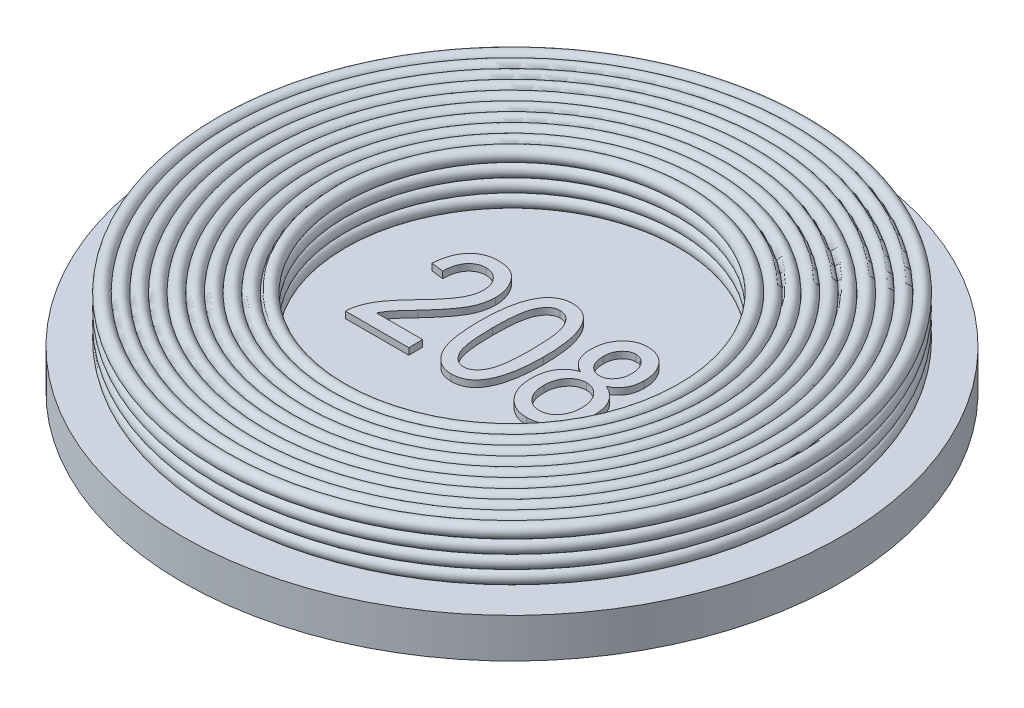
from build123d import *

# Parameters (mm, degrees)
SKETCH3_R           = 5
BOSS_EXTRUDE2_DEPTH = 0.6
BOSS_EXTRUDE3_DEPTH = 0.1


with BuildPart() as part:
    # Sketch2 → Revolve2 (revolve)
    with BuildSketch(Plane.XY, mode=Mode.PRIVATE) as revolve2_sk:
        with BuildLine():
            ThreePointArc((-3.3, 1.3), (-3.4, 1.4), (-3.5, 1.3))
            ThreePointArc((-3.5, 1.3), (-3.6, 1.4), (-3.7, 1.3))
            ThreePointArc((-3.7, 1.3), (-3.8, 1.4), (-3.9, 1.3))
            ThreePointArc((-3.9, 1.3), (-4, 1.4), (-4.1, 1.3))
            ThreePointArc((-4.1, 1.3), (-4.2, 1.4), (-4.3, 1.3))
            ThreePointArc((-4.3, 1.3), (-4.470710678, 1.370710678), (-4.4, 1.2))
            ThreePointArc((-4.4, 1.2), (-4.5, 1.1), (-4.4, 1))
            ThreePointArc((-4.4, 1), (-4.5, 0.9), (-4.4, 0.8))
            ThreePointArc((-4.4, 0.8), (-4.470710678, 0.629289322), (-4.3, 0.7))
            ThreePointArc((-4.3, 0.7), (-4.2, 0.6), (-4.1, 0.7))
            ThreePointArc((-4.1, 0.7), (-4, 0.6), (-3.9, 0.7))
            ThreePointArc((-3.9, 0.7), (-3.8, 0.6), (-3.7, 0.7))
            ThreePointArc((-3.7, 0.7), (-3.6, 0.6), (-3.5, 0.7))
            ThreePointArc((-3.5, 0.7), (-3.4, 0.6), (-3.3, 0.7))
            ThreePointArc((-3.3, 0.7), (-3.2, 0.6), (-3.1, 0.7))
            ThreePointArc((-3.1, 0.7), (-3, 0.6), (-2.9, 0.7))
            ThreePointArc((-2.9, 0.7), (-2.8, 0.6), (-2.7, 0.7))
            ThreePointArc((-2.7, 0.7), (-2.529289322, 0.629289322), (-2.6, 0.8))
            ThreePointArc((-2.6, 0.8), (-2.5, 0.9), (-2.6, 1))
            ThreePointArc((-2.6, 1), (-2.5, 1.1), (-2.6, 1.2))
            ThreePointArc((-2.6, 1.2), (-2.529289322, 1.370710678), (-2.7, 1.3))
            ThreePointArc((-2.7, 1.3), (-2.8, 1.4), (-2.9, 1.3))
            ThreePointArc((-2.9, 1.3), (-3, 1.4), (-3.1, 1.3))
            ThreePointArc((-3.1, 1.3), (-3.2, 1.4), (-3.3, 1.3))
        make_face()
    revolve(revolve2_sk.sketch.rotate(Axis((0, 55, 0), (0, -1, 0)), 270), axis=Axis((0, 55, 0), (0, -1, 0)))


with BuildPart() as body_2:
    # Sketch3 → Boss-Extrude2 (new body)
    with BuildSketch(Plane(origin=(0, 0, 0), x_dir=(1, 0, 0), z_dir=(0, 1, 0))):
        with Locations(Location((0, 0, 0), (0, 0, 270))):
            Circle(SKETCH3_R)
    extrude(amount=BOSS_EXTRUDE2_DEPTH)

    # Sketch5 → Boss-Extrude3 (add)
    # profile 1 of 3: a face of its own
    with BuildSketch(Plane(origin=(0, 0.6, 0), x_dir=(1, 0, 0), z_dir=(0, 1, 0))):
        with BuildLine():
            Line((-0.666233766, -0.68961039), (-0.666233766, -0.9))
            Line((-0.666233766, -0.9), (-1.624675325, -0.9))
            add(Edge.make_bspline(
                [(-1.624675325, -0.9), (-1.624719701, -0.889037821), (-1.624809609, -0.866828267), (-1.62182047, -0.832967842), (-1.615679028, -0.798287637), (-1.607837033, -0.762325012), (-1.59671794, -0.725552953), (-1.583106106, -0.687792785), (-1.56704534, -0.649138519), (-1.548239649, -0.609361228), (-1.526264251, -0.568079364), (-1.499746316, -0.525465641), (-1.469270632, -0.480755667), (-1.434796897, -0.434222007), (-1.395650885, -0.386305977), (-1.352994492, -0.33629627), (-1.306218952, -0.284297047), (-1.272914669, -0.249737881), (-1.255762987, -0.231939935)],
                knots=[0, 0, 0, 0, 0.672188691, 1.361865275, 2.08134618, 2.831455259, 3.618325166, 4.435686407, 5.292818481, 6.184803937, 7.133719261, 8.159707436, 9.261705982, 10.452168352, 11.710682541, 13.056179633, 14.483934645, 16, 16, 16, 16], degree=3))
            add(Edge.make_bspline(
                [(-1.255762987, -0.231939935), (-1.23583081, -0.211323509), (-1.197452953, -0.171628184), (-1.143439785, -0.113015604), (-1.094363398, -0.05853594), (-1.051204304, -0.007204037), (-1.013196274, 0.040280977), (-0.979956904, 0.083851211), (-0.953074704, 0.124495463), (-0.924049572, 0.172319263), (-0.896378232, 0.22925274), (-0.871915199, 0.295617715), (-0.856108949, 0.359772897), (-0.854182245, 0.402069041), (-0.853246753, 0.422605519)],
                knots=[0, 0, 0, 0, 1.312560889, 2.527233899, 3.64818266, 4.668586789, 5.596397896, 6.432357998, 7.175835261, 7.825761013, 8.992224112, 10.065918602, 11.060925749, 12, 12, 12, 12], degree=3))
            add(Edge.make_bspline(
                [(-0.853246753, 0.422605519), (-0.853377195, 0.43394329), (-0.853631961, 0.456087142), (-0.857961355, 0.48842587), (-0.86413564, 0.519185009), (-0.872287527, 0.54858686), (-0.883845962, 0.576148493), (-0.897694917, 0.602061132), (-0.913917003, 0.626442137), (-0.932428866, 0.648933464), (-0.952843239, 0.669223453), (-0.974357124, 0.687451459), (-0.997530188, 0.702204361), (-1.021410011, 0.715047061), (-1.046803539, 0.724354664), (-1.073176051, 0.731449464), (-1.100771543, 0.735449836), (-1.119509074, 0.736056016), (-1.129017857, 0.736363636)],
                knots=[0, 0, 0, 0, 1.164486654, 2.274364258, 3.346924328, 4.388668322, 5.404300818, 6.412115579, 7.404820287, 8.409522099, 9.400647826, 10.360464378, 11.301161788, 12.219192522, 13.141987859, 14.073903283, 15.022558797, 16, 16, 16, 16], degree=3))
            add(Edge.make_bspline(
                [(-1.129017857, 0.736363636), (-1.13927019, 0.736148555), (-1.159283213, 0.735728706), (-1.188453501, 0.730511118), (-1.216403994, 0.723531017), (-1.242992859, 0.712705489), (-1.268025613, 0.698838646), (-1.291862863, 0.682147262), (-1.314038026, 0.662315835), (-1.334997803, 0.639765128), (-1.353371718, 0.614050176), (-1.370241667, 0.586223786), (-1.383526041, 0.555107234), (-1.394821592, 0.52166), (-1.403667786, 0.485492199), (-1.40958076, 0.446740235), (-1.413917037, 0.405413557), (-1.414160562, 0.376960369), (-1.414285714, 0.362337662)],
                knots=[0, 0, 0, 0, 0.928788257, 1.813037313, 2.680996359, 3.53827917, 4.408273621, 5.272359245, 6.172129225, 7.102295458, 8.058839945, 9.034325244, 10.048074492, 11.120300332, 12.234644845, 13.420320921, 14.674247329, 16, 16, 16, 16], degree=3))
            Line((-1.414285714, 0.362337662), (-1.601298701, 0.385714286))
            add(Edge.make_bspline(
                [(-1.601298701, 0.385714286), (-1.599371441, 0.407415656), (-1.59563247, 0.4495173), (-1.585822448, 0.510465965), (-1.572209278, 0.567015407), (-1.556049596, 0.619729776), (-1.535718852, 0.667954859), (-1.512988437, 0.712568298), (-1.48604745, 0.752600277), (-1.456003805, 0.788545701), (-1.423109105, 0.820436622), (-1.387548749, 0.84796415), (-1.349371026, 0.871169337), (-1.309011928, 0.890681158), (-1.265637213, 0.905251715), (-1.220025024, 0.915826699), (-1.171804379, 0.922091825), (-1.138898246, 0.922942031), (-1.122077922, 0.923376623)],
                knots=[0, 0, 0, 0, 1.296155121, 2.514599762, 3.669097984, 4.755193195, 5.79120272, 6.77953026, 7.729955905, 8.65570694, 9.562583864, 10.450894749, 11.325630111, 12.216772649, 13.112585423, 14.04224033, 14.999270054, 16, 16, 16, 16], degree=3))
            add(Edge.make_bspline(
                [(-1.122077922, 0.923376623), (-1.103916839, 0.922843524), (-1.068554194, 0.921805492), (-1.017074518, 0.914965687), (-0.96906031, 0.90290073), (-0.924297108, 0.886112157), (-0.883322504, 0.864010462), (-0.845470008, 0.837498875), (-0.811371336, 0.805771471), (-0.781026629, 0.769670163), (-0.754209539, 0.730694466), (-0.730809875, 0.689939291), (-0.710512546, 0.648079945), (-0.694649609, 0.60465065), (-0.681402369, 0.56023426), (-0.673080162, 0.514157481), (-0.66722139, 0.466951954), (-0.666564833, 0.43504296), (-0.666233766, 0.418952922)],
                knots=[0, 0, 0, 0, 1.141256367, 2.222215694, 3.255808886, 4.246221905, 5.218350639, 6.173592628, 7.142736081, 8.136099926, 9.131465336, 10.11177911, 11.087094076, 12.050634184, 13.014356534, 13.995714735, 14.989343724, 16, 16, 16, 16], degree=3))
            add(Edge.make_bspline(
                [(-0.666233766, 0.418952922), (-0.666545694, 0.404456502), (-0.667165486, 0.375652527), (-0.671197287, 0.332675363), (-0.678314162, 0.290275994), (-0.68755511, 0.248046737), (-0.700668079, 0.206641451), (-0.715512659, 0.16540252), (-0.733517984, 0.124795174), (-0.754773717, 0.084026767), (-0.77966142, 0.041654603), (-0.809485119, -0.003094656), (-0.843691732, -0.051417175), (-0.88367068, -0.102451954), (-0.927484782, -0.157666612), (-0.977069672, -0.215669898), (-1.03145792, -0.276973298), (-1.069776023, -0.318569623), (-1.089569805, -0.340056818)],
                knots=[0, 0, 0, 0, 0.78053567, 1.550902233, 2.321464013, 3.094364546, 3.87611052, 4.657966429, 5.453363508, 6.265521698, 7.132350641, 8.097801917, 9.160103787, 10.319208993, 11.587678713, 12.955014444, 14.427067756, 16, 16, 16, 16], degree=3))
            add(Edge.make_bspline(
                [(-1.089569805, -0.340056818), (-1.102135575, -0.353426185), (-1.12614977, -0.378976119), (-1.160156747, -0.415947193), (-1.190673232, -0.449579319), (-1.218363625, -0.479399021), (-1.241858976, -0.506409132), (-1.262229163, -0.529896148), (-1.27887317, -0.550149566), (-1.303817311, -0.581989205), (-1.335278337, -0.626850968), (-1.357014067, -0.669143904), (-1.367532468, -0.68961039)],
                knots=[0, 0, 0, 0, 1.227496676, 2.345844757, 3.360613726, 4.265798447, 5.068085109, 5.75545707, 6.345771879, 6.821573405, 8.46188917, 10, 10, 10, 10], degree=3))
            Line((-1.367532468, -0.68961039), (-0.666233766, -0.68961039))
        make_face()
    # profile 2 of 3: a face of its own
    with BuildSketch(Plane(origin=(0, 0.6, 0), x_dir=(1, 0, 0), z_dir=(0, 1, 0))):
        with BuildLine():
            add(Edge.make_bspline(
                [(-0.479220779, -0.000730519), (-0.478923809, 0.03604733), (-0.478347164, 0.107461069), (-0.472387662, 0.211038612), (-0.462987763, 0.307803048), (-0.450205169, 0.397624627), (-0.432905434, 0.480516835), (-0.412533268, 0.55661266), (-0.387512185, 0.625670108), (-0.359349411, 0.687985295), (-0.327053186, 0.743210271), (-0.291447965, 0.791534805), (-0.251477565, 0.832174594), (-0.208244123, 0.86596816), (-0.160887567, 0.891712942), (-0.11008193, 0.910215193), (-0.055639399, 0.921380206), (-0.018072148, 0.922702136), (0.001095779, 0.923376623)],
                knots=[0, 0, 0, 0, 1.522295809, 2.955932353, 4.292935845, 5.545987552, 6.709403679, 7.796379217, 8.803980711, 9.746667296, 10.623167879, 11.447716403, 12.224665142, 12.975696349, 13.710987297, 14.4460191, 15.207112772, 16, 16, 16, 16], degree=3))
            add(Edge.make_bspline(
                [(0.001095779, 0.923376623), (0.018177464, 0.922828654), (0.051721984, 0.921752567), (0.100671924, 0.912878552), (0.146712505, 0.897781776), (0.189878504, 0.876801753), (0.230038797, 0.849714656), (0.267588513, 0.816962976), (0.302116167, 0.77788637), (0.322109578, 0.748530651), (0.332386364, 0.733441558)],
                knots=[0, 0, 0, 0, 1.02435884, 2.0116063, 2.972586715, 3.92329494, 4.881606269, 5.870473939, 6.905405214, 8, 8, 8, 8], degree=3))
            add(Edge.make_bspline(
                [(0.332386364, 0.733441558), (0.344282037, 0.713098044), (0.369020344, 0.67079156), (0.398559083, 0.599907974), (0.423457514, 0.52073696), (0.44445086, 0.433026546), (0.459425894, 0.336595881), (0.471277715, 0.231820066), (0.478136968, 0.11843574), (0.478850844, 0.039944233), (0.479220779, -0.000730519)],
                knots=[0, 0, 0, 0, 0.745747152, 1.550859881, 2.42529298, 3.372802996, 4.404287875, 5.514077945, 6.711780846, 8, 8, 8, 8], degree=3))
            add(Edge.make_bspline(
                [(0.479220779, -0.000730519), (0.478927409, -0.03726533), (0.478357865, -0.108193319), (0.472338724, -0.211277582), (0.463064065, -0.307571802), (0.450107855, -0.397119427), (0.432968558, -0.479808131), (0.412325704, -0.555883263), (0.388085495, -0.625311137), (0.359532888, -0.687632969), (0.327712091, -0.743180146), (0.291502868, -0.791014984), (0.252495755, -0.832381143), (0.208701123, -0.865442746), (0.16166769, -0.891916234), (0.11051965, -0.91010664), (0.05589564, -0.92142814), (0.018198162, -0.922716981), (-0.001095779, -0.923376623)],
                knots=[0, 0, 0, 0, 1.513874866, 2.939007974, 4.277477108, 5.521918538, 6.686610019, 7.774777114, 8.786532326, 9.730252297, 10.61206932, 11.433487149, 12.211385775, 12.960169701, 13.698700869, 14.439280195, 15.201208188, 16, 16, 16, 16], degree=3))
            add(Edge.make_bspline(
                [(-0.001095779, -0.923376623), (-0.018304483, -0.922730717), (-0.05213873, -0.921460791), (-0.101782472, -0.911805323), (-0.148767566, -0.895157508), (-0.193342203, -0.872286004), (-0.235565642, -0.843044987), (-0.274921989, -0.806818526), (-0.312362105, -0.764560226), (-0.347435697, -0.71549101), (-0.379130024, -0.658349549), (-0.405921907, -0.59177578), (-0.428747771, -0.516087703), (-0.446861198, -0.430979747), (-0.462107261, -0.336799774), (-0.471688825, -0.233075405), (-0.4780396, -0.120006798), (-0.478816769, -0.041527776), (-0.479220779, -0.000730519)],
                knots=[0, 0, 0, 0, 0.713782411, 1.403376538, 2.088831486, 2.775699897, 3.476400496, 4.213162367, 4.989742879, 5.815463779, 6.710980744, 7.6941898, 8.787315853, 9.987366569, 11.302150399, 12.743876293, 14.307306722, 16, 16, 16, 16], degree=3))
        make_face()
        with BuildLine():
            add(Edge.make_bspline(
                [(-0.292207792, 0), (-0.291881699, -0.035067444), (-0.291258764, -0.102056671), (-0.287835373, -0.198187175), (-0.281364831, -0.285185516), (-0.272377909, -0.363325815), (-0.260983971, -0.432285297), (-0.246921228, -0.492443633), (-0.230164092, -0.543556211), (-0.210449316, -0.586350776), (-0.188586997, -0.621875765), (-0.16523522, -0.652147255), (-0.141090212, -0.678400701), (-0.114696435, -0.69937188), (-0.087294731, -0.716328554), (-0.057826255, -0.727392825), (-0.027330469, -0.735378935), (-0.006262585, -0.736033089), (0.004383117, -0.736363636)],
                knots=[0, 0, 0, 0, 1.930873368, 3.688541263, 5.295281011, 6.732986767, 8.018032389, 9.141589856, 10.131594649, 10.974379403, 11.729767228, 12.422984227, 13.077418253, 13.687793181, 14.274134012, 14.843047171, 15.415386244, 16, 16, 16, 16], degree=3))
            add(Edge.make_bspline(
                [(0.004383117, -0.736363636), (0.014418296, -0.736017057), (0.034399934, -0.735326964), (0.063526866, -0.727422387), (0.09160657, -0.715827255), (0.118167127, -0.699046142), (0.143170396, -0.677462363), (0.166955253, -0.651257701), (0.189557111, -0.620403347), (0.211230939, -0.584345643), (0.230736251, -0.54133367), (0.247327012, -0.489978211), (0.261287231, -0.429839172), (0.272834834, -0.360915579), (0.28120071, -0.283084227), (0.287898444, -0.196611324), (0.291232953, -0.101202605), (0.291873528, -0.034701552), (0.292207792, 0)],
                knots=[0, 0, 0, 0, 0.556098029, 1.107279675, 1.665020537, 2.239289732, 2.843790749, 3.494855459, 4.20099618, 4.965402842, 5.827994078, 6.818278647, 7.958442113, 9.254955883, 10.697998423, 12.305588537, 14.072183745, 16, 16, 16, 16], degree=3))
            add(Edge.make_bspline(
                [(0.292207792, 0), (0.291875015, 0.035067026), (0.291237003, 0.102298777), (0.287887283, 0.198556457), (0.281299335, 0.285786032), (0.272471412, 0.36382933), (0.260859073, 0.43286411), (0.24707485, 0.492980449), (0.230043723, 0.543990181), (0.210608924, 0.586699386), (0.188301626, 0.621908348), (0.165525423, 0.652639305), (0.140566002, 0.678243201), (0.114330954, 0.699563377), (0.086438195, 0.716176834), (0.056765325, 0.728048495), (0.025543047, 0.735192292), (0.004176194, 0.735971548), (-0.006574675, 0.736363636)],
                knots=[0, 0, 0, 0, 1.926173374, 3.692928135, 5.28908838, 6.72993665, 8.005261178, 9.132588719, 10.113846285, 10.954579593, 11.702439438, 12.399284011, 13.051919516, 13.660808713, 14.251466784, 14.827675714, 15.41013748, 16, 16, 16, 16], degree=3))
            add(Edge.make_bspline(
                [(-0.006574675, 0.736363636), (-0.016611489, 0.736026213), (-0.036478087, 0.735358326), (-0.065362847, 0.727420435), (-0.093073501, 0.715813906), (-0.119439489, 0.698958147), (-0.144128114, 0.67707019), (-0.168105852, 0.651027829), (-0.19021202, 0.619895213), (-0.211965326, 0.5841676), (-0.231128587, 0.541040588), (-0.247745087, 0.489774465), (-0.261109544, 0.429527541), (-0.272919199, 0.360811343), (-0.281178169, 0.283079453), (-0.287905402, 0.196612798), (-0.291230953, 0.101202182), (-0.291872842, 0.034701407), (-0.292207792, 0)],
                knots=[0, 0, 0, 0, 0.557102101, 1.102712893, 1.655222221, 2.224793741, 2.834805151, 3.487045402, 4.190458401, 4.956245252, 5.811421647, 6.809929224, 7.950602775, 9.242777249, 10.688425301, 12.298918027, 14.068702942, 16, 16, 16, 16], degree=3))
        make_face(mode=Mode.SUBTRACT)
    # profile 3 of 3: a face of its own
    with BuildSketch(Plane(origin=(0, 0.6, 0), x_dir=(1, 0, 0), z_dir=(0, 1, 0))):
        with BuildLine():
            add(Edge.make_bspline(
                [(0.955154221, 0.087662338), (0.937947262, 0.096309357), (0.90437619, 0.113179841), (0.859629769, 0.146224224), (0.821474197, 0.184599502), (0.790043995, 0.228582093), (0.765726432, 0.278214879), (0.748819223, 0.333323599), (0.737825733, 0.393801404), (0.736863654, 0.436068445), (0.736363636, 0.458035714)],
                knots=[0, 0, 0, 0, 1.008302473, 1.967215395, 2.901654035, 3.835241807, 4.788827276, 5.786238528, 6.849451133, 8, 8, 8, 8], degree=3))
            add(Edge.make_bspline(
                [(0.736363636, 0.458035714), (0.736698491, 0.474852542), (0.737353082, 0.507726943), (0.74293989, 0.555874324), (0.752115669, 0.601517083), (0.764263697, 0.644990708), (0.781069706, 0.685633798), (0.800665639, 0.724407261), (0.824582802, 0.760448481), (0.851469119, 0.79408521), (0.881307697, 0.82422102), (0.913200019, 0.850710713), (0.947043536, 0.873271785), (0.982910765, 0.891460027), (1.020471842, 0.90585763), (1.059876216, 0.91623173), (1.101212265, 0.921945559), (1.129366773, 0.922895458), (1.143628247, 0.923376623)],
                knots=[0, 0, 0, 0, 1.165528948, 2.278436123, 3.35437051, 4.390847764, 5.401785756, 6.398351761, 7.397951243, 8.394481506, 9.379254266, 10.332413116, 11.264104055, 12.192693114, 13.114390379, 14.047914605, 15.011184464, 16, 16, 16, 16], degree=3))
            add(Edge.make_bspline(
                [(1.143628247, 0.923376623), (1.158017052, 0.922936637), (1.186442485, 0.922067433), (1.228075827, 0.915755221), (1.267863589, 0.905492898), (1.305806186, 0.891229841), (1.34184304, 0.872446017), (1.375742164, 0.849319923), (1.407923481, 0.822279695), (1.437957748, 0.791501597), (1.465218083, 0.757339002), (1.488980045, 0.720532136), (1.509764094, 0.68174718), (1.526102284, 0.640126697), (1.538932871, 0.59611101), (1.547926707, 0.549646726), (1.553551781, 0.500909553), (1.554210012, 0.467669858), (1.554545455, 0.450730519)],
                knots=[0, 0, 0, 0, 0.985268531, 1.946421878, 2.87680472, 3.795226773, 4.71648376, 5.65319809, 6.600248485, 7.590936614, 8.593729089, 9.588305238, 10.588007114, 11.602279753, 12.644649782, 13.724021809, 14.840134863, 16, 16, 16, 16], degree=3))
            add(Edge.make_bspline(
                [(1.554545455, 0.450730519), (1.554011676, 0.429617675), (1.552983474, 0.388948585), (1.542378691, 0.330542433), (1.525869516, 0.276995782), (1.501832508, 0.228610573), (1.471106576, 0.185135087), (1.433372818, 0.146994944), (1.389010107, 0.113339042), (1.35530541, 0.096391075), (1.337946429, 0.087662338)],
                knots=[0, 0, 0, 0, 1.126288406, 2.16953834, 3.158564267, 4.109347243, 5.041996175, 5.989081932, 6.964313779, 8, 8, 8, 8], degree=3))
            add(Edge.make_bspline(
                [(1.337946429, 0.087662338), (1.349230994, 0.083097381), (1.371576975, 0.074057741), (1.403221956, 0.057473753), (1.433075552, 0.039301995), (1.460479138, 0.018614708), (1.486252169, -0.003703329), (1.51005597, -0.028185713), (1.531601126, -0.05490816), (1.550922242, -0.083617672), (1.568753319, -0.113892225), (1.583417954, -0.146495073), (1.596457404, -0.180552776), (1.606526442, -0.21654591), (1.614596762, -0.254241125), (1.620307799, -0.293655922), (1.624196147, -0.334865453), (1.624513036, -0.362936978), (1.624675325, -0.377313312)],
                knots=[0, 0, 0, 0, 0.998518868, 1.977292132, 2.928488769, 3.863806314, 4.791620617, 5.724425947, 6.662355446, 7.604692757, 8.562792825, 9.541974082, 10.534927333, 11.553397264, 12.605860047, 13.696849039, 14.820482036, 16, 16, 16, 16], degree=3))
            add(Edge.make_bspline(
                [(1.624675325, -0.377313312), (1.624223711, -0.396928589), (1.623337796, -0.435407182), (1.617295802, -0.491811654), (1.606092113, -0.545370057), (1.591354907, -0.596354746), (1.571804658, -0.64433882), (1.548401925, -0.689792827), (1.520114594, -0.732103391), (1.488051643, -0.771465495), (1.453002052, -0.807018261), (1.415347941, -0.838002641), (1.3757983, -0.864483236), (1.333989183, -0.886304931), (1.289809844, -0.902530831), (1.243911391, -0.914909155), (1.195821055, -0.9217425), (1.163128481, -0.922826789), (1.146550325, -0.923376623)],
                knots=[0, 0, 0, 0, 1.159749967, 2.275040396, 3.347967098, 4.391166783, 5.408413163, 6.406504519, 7.408740576, 8.411571025, 9.404143995, 10.355316395, 11.289670068, 12.213679047, 13.136228826, 14.066859406, 15.019719104, 16, 16, 16, 16], degree=3))
            add(Edge.make_bspline(
                [(1.146550325, -0.923376623), (1.129728002, -0.922832887), (1.096669801, -0.92176437), (1.048103693, -0.914894228), (1.001924335, -0.90261402), (0.957584173, -0.88619802), (0.915524175, -0.864614832), (0.875912536, -0.837867462), (0.837905214, -0.807163321), (0.80291911, -0.771416741), (0.770593975, -0.732192366), (0.743031275, -0.689180437), (0.71889021, -0.643644541), (0.699647639, -0.594846435), (0.684605291, -0.543118327), (0.674211469, -0.488316834), (0.667411436, -0.430690138), (0.666631207, -0.391213098), (0.666233766, -0.371103896)],
                knots=[0, 0, 0, 0, 0.984972937, 1.935608695, 2.864070717, 3.777636659, 4.698984135, 5.624239024, 6.571662262, 7.554569506, 8.54763434, 9.542156389, 10.540146702, 11.560717074, 12.60743999, 13.689489912, 14.823049757, 16, 16, 16, 16], degree=3))
            add(Edge.make_bspline(
                [(0.666233766, -0.371103896), (0.666410394, -0.356364205), (0.666756926, -0.327445849), (0.670475635, -0.284980879), (0.676674163, -0.244493242), (0.685041703, -0.206047504), (0.69559739, -0.169606513), (0.708774625, -0.13514516), (0.724457977, -0.102664448), (0.742491814, -0.072170353), (0.762441775, -0.043764268), (0.784411451, -0.017693259), (0.808342082, 0.005806298), (0.834014807, 0.027042077), (0.8614704, 0.046266965), (0.891084624, 0.062515159), (0.922352192, 0.076610249), (0.944127391, 0.083947034), (0.955154221, 0.087662338)],
                knots=[0, 0, 0, 0, 1.21084686, 2.375606163, 3.49898943, 4.574306622, 5.606312177, 6.613285576, 7.602106595, 8.566331322, 9.521116698, 10.451051306, 11.363604456, 12.273026677, 13.186018397, 14.112988761, 15.044428814, 16, 16, 16, 16], degree=3))
        make_face()
        with BuildLine():
            add(Edge.make_bspline(
                [(0.923376623, 0.463149351), (0.924078845, 0.442269162), (0.925422492, 0.402316506), (0.937481469, 0.345513185), (0.958020667, 0.295474671), (0.986135412, 0.252674892), (1.020529758, 0.218707683), (1.05889093, 0.193205338), (1.10161357, 0.177875886), (1.131454598, 0.17618171), (1.146550325, 0.175324675)],
                knots=[0, 0, 0, 0, 1.231806288, 2.356967922, 3.407623546, 4.408504678, 5.359070988, 6.242373184, 7.110866593, 8, 8, 8, 8], degree=3))
            add(Edge.make_bspline(
                [(1.146550325, 0.175324675), (1.161416599, 0.176162899), (1.190811037, 0.177820282), (1.232616689, 0.193433058), (1.270905776, 0.217849569), (1.304519877, 0.25163409), (1.332651755, 0.292939316), (1.353264948, 0.340735729), (1.36544748, 0.394243078), (1.366820119, 0.431671721), (1.367532468, 0.451095779)],
                knots=[0, 0, 0, 0, 0.904069307, 1.787576968, 2.686104763, 3.657927982, 4.673759711, 5.718490521, 6.815982417, 8, 8, 8, 8], degree=3))
            add(Edge.make_bspline(
                [(1.367532468, 0.451095779), (1.366847814, 0.471132031), (1.365526569, 0.509798007), (1.352977381, 0.564874896), (1.331941499, 0.614275331), (1.302654186, 0.656622584), (1.268530926, 0.691829761), (1.230085544, 0.717412866), (1.188304795, 0.733488507), (1.159108524, 0.735398647), (1.144358766, 0.736363636)],
                knots=[0, 0, 0, 0, 1.195037322, 2.306184118, 3.351541185, 4.382027117, 5.363972266, 6.261309376, 7.121625266, 8, 8, 8, 8], degree=3))
            add(Edge.make_bspline(
                [(1.144358766, 0.736363636), (1.129618503, 0.735516454), (1.100469513, 0.733841145), (1.058719886, 0.718267105), (1.020667825, 0.692923729), (0.987007625, 0.658665929), (0.95825652, 0.617670664), (0.938355373, 0.570300742), (0.92530464, 0.518393326), (0.924033946, 0.481983776), (0.923376623, 0.463149351)],
                knots=[0, 0, 0, 0, 0.904281018, 1.788222997, 2.702503877, 3.698439792, 4.727116192, 5.763971808, 6.843317031, 8, 8, 8, 8], degree=3))
        make_face(mode=Mode.SUBTRACT)
        with BuildLine():
            add(Edge.make_bspline(
                [(0.853246753, -0.370373377), (0.853539913, -0.383777336), (0.854114254, -0.410037507), (0.858230271, -0.448363428), (0.864584208, -0.484720784), (0.874272987, -0.518875167), (0.886228984, -0.551252664), (0.901230983, -0.581575818), (0.918955279, -0.609869174), (0.93875682, -0.636162197), (0.96113141, -0.659194741), (0.98420375, -0.680037262), (1.008519515, -0.697547444), (1.034194256, -0.711673241), (1.060837747, -0.722529972), (1.088441686, -0.730740785), (1.117154869, -0.735624339), (1.136669691, -0.736115138), (1.146550325, -0.736363636)],
                knots=[0, 0, 0, 0, 1.229957658, 2.409653497, 3.534020377, 4.613053928, 5.663236106, 6.697665706, 7.711552779, 8.723960985, 9.711901018, 10.6537745, 11.574735704, 12.45493582, 13.336836533, 14.210201145, 15.093799183, 16, 16, 16, 16], degree=3))
            add(Edge.make_bspline(
                [(1.146550325, -0.736363636), (1.156556839, -0.736134377), (1.176201579, -0.735684297), (1.205065061, -0.730575801), (1.232791812, -0.723083528), (1.25933566, -0.712303042), (1.284780955, -0.698741009), (1.308875629, -0.681870012), (1.331718531, -0.661758322), (1.35351857, -0.639117306), (1.372970794, -0.613414134), (1.390949796, -0.586185242), (1.404811886, -0.556158286), (1.417278306, -0.524728749), (1.426026269, -0.490805944), (1.433344014, -0.455026437), (1.436617789, -0.416942503), (1.437309197, -0.390952902), (1.437662338, -0.377678571)],
                knots=[0, 0, 0, 0, 0.929108295, 1.824020855, 2.716353585, 3.594799272, 4.480866403, 5.391315445, 6.321801218, 7.306391719, 8.306918377, 9.31465165, 10.332061206, 11.374528197, 12.453461109, 13.583192095, 14.765602254, 16, 16, 16, 16], degree=3))
            add(Edge.make_bspline(
                [(1.437662338, -0.377678571), (1.437356921, -0.364276911), (1.436758567, -0.338021245), (1.432812031, -0.299640825), (1.425841451, -0.263376247), (1.416306014, -0.229169163), (1.404293314, -0.196807065), (1.389334848, -0.166394635), (1.371349401, -0.138176165), (1.350786744, -0.112342677), (1.328815283, -0.088730398), (1.305365163, -0.06809268), (1.280663823, -0.050853496), (1.255074638, -0.036384333), (1.228235869, -0.02554091), (1.200530586, -0.017256961), (1.171557816, -0.012436835), (1.151803208, -0.011939898), (1.141801948, -0.011688312)],
                knots=[0, 0, 0, 0, 1.22586307, 2.401631645, 3.524301147, 4.599742544, 5.646428614, 6.677414549, 7.693861764, 8.700930997, 9.693673486, 10.640764112, 11.552218418, 12.444626848, 13.323591672, 14.194048812, 15.08569251, 16, 16, 16, 16], degree=3))
            add(Edge.make_bspline(
                [(1.141801948, -0.011688312), (1.13192356, -0.011942914), (1.112413175, -0.012445767), (1.08378315, -0.017221683), (1.056558335, -0.025659035), (1.029953894, -0.035825779), (1.005098841, -0.050662669), (0.980788254, -0.067593343), (0.958212451, -0.088411484), (0.936683176, -0.11162637), (0.917110435, -0.137435139), (0.899800281, -0.165226269), (0.885550332, -0.195061351), (0.873953783, -0.22667147), (0.864276893, -0.259920186), (0.857768958, -0.295155324), (0.854237346, -0.332191922), (0.853581774, -0.357460312), (0.853246753, -0.370373377)],
                knots=[0, 0, 0, 0, 0.923472587, 1.823911596, 2.703001348, 3.586871794, 4.479500873, 5.402130619, 6.35347509, 7.344669241, 8.360414412, 9.377945173, 10.401637647, 11.446516964, 12.524200813, 13.636404357, 14.792116778, 16, 16, 16, 16], degree=3))
        make_face(mode=Mode.SUBTRACT)
    extrude(amount=BOSS_EXTRUDE3_DEPTH)


solid = Compound([part.part, body_2.part])
